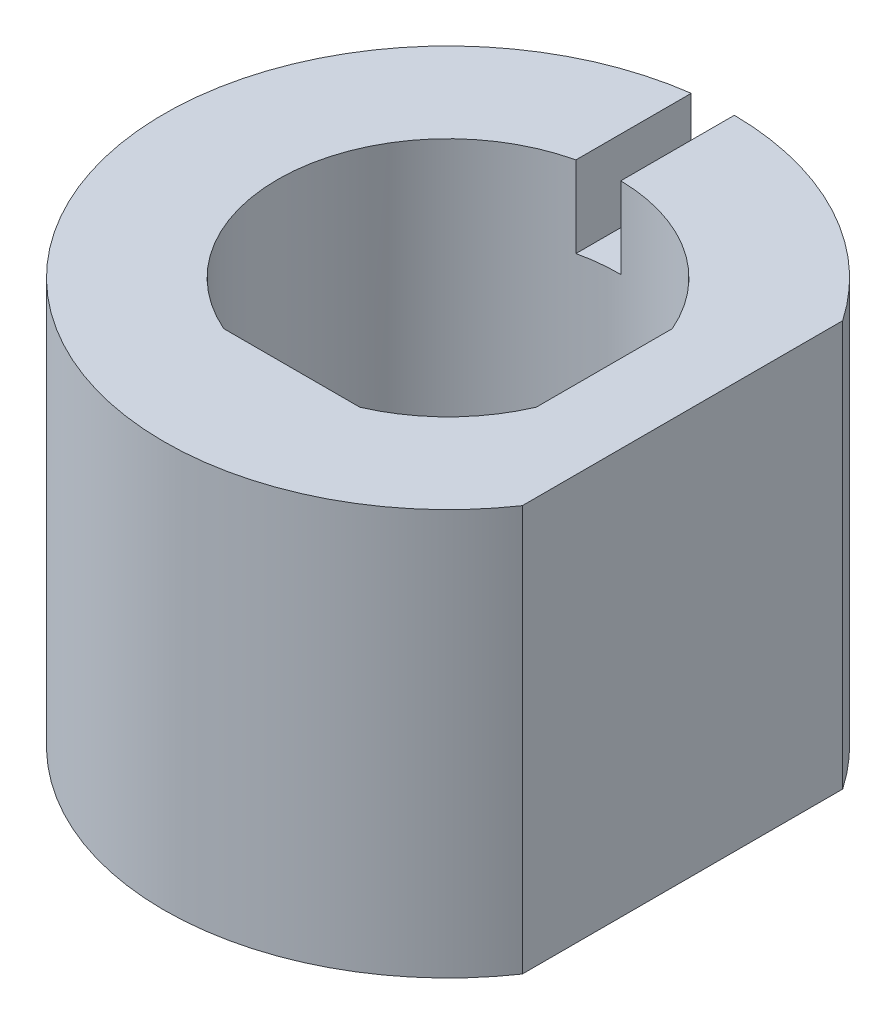
from build123d import *

# Parameters (mm, degrees)
SKETCH_1_R          = 7
EXTRUDE_1_DEPTH     = 10
SKETCH_2_R          = 7
EXTRUDE_2_DEPTH     = 5
SKETCH_3_R          = 7
EXTRUDE_3_DEPTH     = 5
SKETCH_4_W          = 1
SKETCH_4_H          = 6.733120112
SKETCH_4_H_2        = 7.353904236
CUT_EXTRUDE_7_DEPTH = 2
SKETCH_5_W          = 27.756401141
SKETCH_5_H          = 22.395981082
CUT_EXTRUDE_8_DEPTH = 10


with BuildPart() as part:
    # Эскиз1 → Вытянуть1 (new body)
    with BuildSketch(Plane(origin=(0, 0, 0), x_dir=(1, 0, 0), z_dir=(0, 1, 0))):
        with Locations(Location((0, 0, 0), (0, 0, 270))):
            Circle(SKETCH_1_R)
        with BuildLine():
            Line((3.85, -1.678541033), (3.85, 1.678541033))
            ThreePointArc((3.85, 1.678541033), (-2.969848481, 2.969848481), (-1.678541033, -3.85))
            Line((-1.678541033, -3.85), (1.678541033, -3.85))
            ThreePointArc((1.678541033, -3.85), (2.969848481, -2.969848481), (3.85, -1.678541033))
        make_face(mode=Mode.SUBTRACT)
    extrude(amount=EXTRUDE_1_DEPTH)

    # Эскиз2 → Вытянуть2 (add)
    with BuildSketch(Plane(origin=(0, 0, 0), x_dir=(1, 0, 0), z_dir=(0, 1, 0))):
        with Locations((12, 0)):
            Circle(SKETCH_2_R)
        with BuildLine():
            Line((15.9, 1.558845727), (15.9, -1.558845727))
            ThreePointArc((15.9, -1.558845727), (14.969848481, -2.969848481), (13.558845727, -3.9))
            Line((13.558845727, -3.9), (10.441154273, -3.9))
            ThreePointArc((10.441154273, -3.9), (9.030151519, 2.969848481), (15.9, 1.558845727))
        make_face(mode=Mode.SUBTRACT)
    extrude(amount=EXTRUDE_2_DEPTH)

    # Эскиз3 → Вытянуть3 (add)
    with BuildSketch(Plane(origin=(0, 0, 0), x_dir=(1, 0, 0), z_dir=(0, 1, 0))):
        with Locations((24, 0)):
            Circle(SKETCH_3_R)
        with BuildLine():
            Line((27.8, 1.846787752), (27.8, -1.846787752))
            ThreePointArc((27.8, -1.846787752), (26.987526151, -2.987526151), (25.846787752, -3.8))
            Line((25.846787752, -3.8), (22.153212248, -3.8))
            ThreePointArc((22.153212248, -3.8), (21.012473849, 2.987526151), (27.8, 1.846787752))
        make_face(mode=Mode.SUBTRACT)
    extrude(amount=EXTRUDE_3_DEPTH)

    # Эскиз4 → Вытянуть7 (cut)
    with BuildSketch(Plane(origin=(0, 10, 0), x_dir=(1, 0, 0), z_dir=(0, 1, 0))):
        with Locations((-0.44096135, 5.658686052)):
            Rectangle(SKETCH_4_W, SKETCH_4_H)
        with Locations((11.258431752, 5.34829399)):
            Rectangle(SKETCH_4_W, SKETCH_4_H_2)
        with Locations((13.407299873, 5.34829399)):
            Rectangle(SKETCH_4_W, SKETCH_4_H_2)
    extrude(amount=-CUT_EXTRUDE_7_DEPTH, mode=Mode.SUBTRACT)

    # Эскиз5 → Вытянуть8 (cut)
    with BuildSketch(Plane(origin=(0, 10, 0), x_dir=(1, 0, 0), z_dir=(0, 1, 0))):
        with Locations((19.658233263, 0.883423561)):
            Rectangle(SKETCH_5_W, SKETCH_5_H)
    extrude(amount=-CUT_EXTRUDE_8_DEPTH, mode=Mode.SUBTRACT)


solid = part.part
